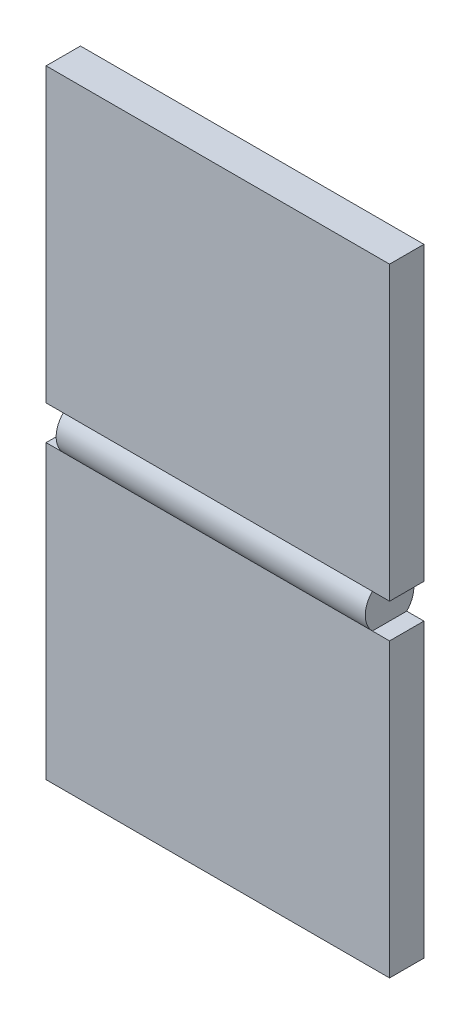
from build123d import *

# Parameters (mm, degrees)
SKETCH1_W                = 17
SKETCH1_H                = 20
BOSS_EXTRUDE1_DEPTH      = 2
BOSS_EXTRUDE1_2_DEPTH    = 2
BOSS_EXTRUDE2_DEPTH      = 9
BOSS_EXTRUDE2_DEPTH_BACK = 9
SKETCH2_R                = 1.414213562


with BuildPart() as part:
    # Sketch1 → Boss-Extrude1 (new body)
    with BuildSketch(Plane(origin=(0, 0, 0), x_dir=(0, 1, 0), z_dir=(0, 0, 1))):
        with Locations((-9.5, 0)):
            Rectangle(SKETCH1_W, SKETCH1_H)
    extrude(amount=BOSS_EXTRUDE1_DEPTH)



with BuildPart() as body_2:
    # Sketch1 → Boss-Extrude1 2 (new body)
    with BuildSketch(Plane(origin=(0, 0, 0), x_dir=(0, 1, 0), z_dir=(0, 0, 1))):
        with Locations((9.5, 0)):
            Rectangle(SKETCH1_W, SKETCH1_H)
    extrude(amount=BOSS_EXTRUDE1_2_DEPTH)


with BuildPart() as part_1:
    add(part.part)

    add(body_2.part)  # Boss-Extrude2 merges body 2
    # Sketch2 → Boss-Extrude2 (add, two sides: drawn at the far end of the back side and taken through both)
    with BuildSketch(Plane.YZ.offset(-BOSS_EXTRUDE2_DEPTH_BACK)):
        with Locations((0, 1)):
            Circle(SKETCH2_R)
    extrude(amount=BOSS_EXTRUDE2_DEPTH + BOSS_EXTRUDE2_DEPTH_BACK)


solid = part_1.part
